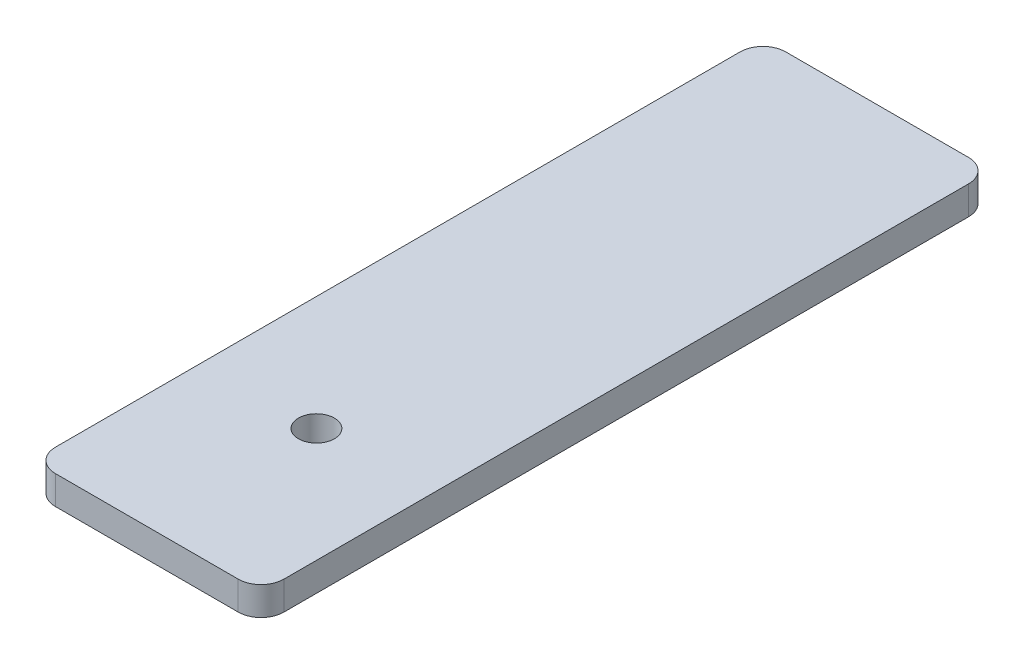
from build123d import *

# Parameters (mm, degrees)
SKETCH1_W           = 25.4
SKETCH1_H           = 81.175
BOSS_EXTRUDE1_DEPTH = 3.175
SKETCH2_R           = 2
CUT_EXTRUDE1_DEPTH  = 63.137257853
FILLET1_R           = 2.54


with BuildPart() as part:
    # Sketch1 → Boss-Extrude1 (new body)
    with BuildSketch(Plane(origin=(0, 0, 0), x_dir=(1, 0, 0), z_dir=(0, 1, 0))):
        with Locations((-13.581081081, 15.628716216)):
            Rectangle(SKETCH1_W, SKETCH1_H)
    extrude(amount=BOSS_EXTRUDE1_DEPTH)

    # Sketch2 → Cut-Extrude1 (cut, through all)
    with BuildSketch(Plane(origin=(0, 3.175, 0), x_dir=(1, 0, 0), z_dir=(0, 1, 0))):
        with Locations(Location((-13.581081081, -6.108783784, 0), (0, 0, 270))):
            Circle(SKETCH2_R)
    extrude(amount=-CUT_EXTRUDE1_DEPTH, mode=Mode.SUBTRACT)

    # Fillet1
    fillet1_edges = [part.edges().sort_by_distance(p)[0] for p in [
        (-26.281081081, 1.5875, -56.216216216),
        (-0.881081081, 1.5875, -56.216216216),
        (-0.881081081, 1.5875, 24.958783784),
        (-26.281081081, 1.5875, 24.958783784),
    ]]
    fillet(fillet1_edges, radius=FILLET1_R)


solid = part.part
